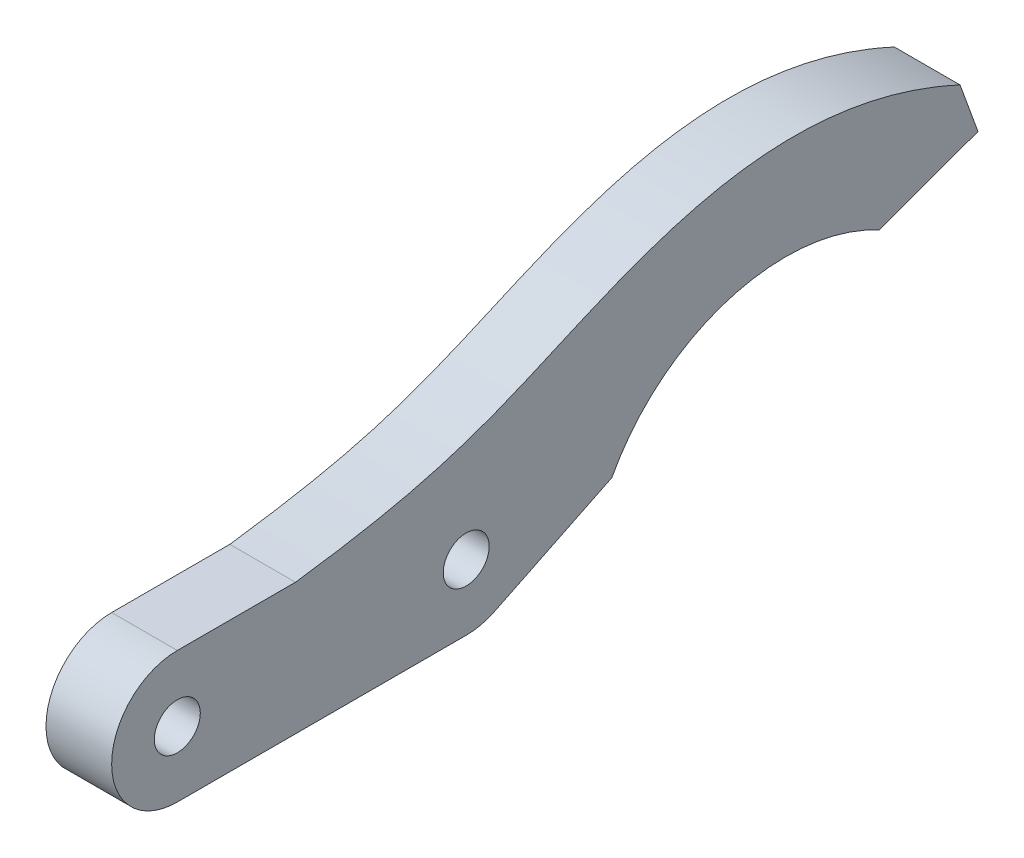
from build123d import *

# Parameters (mm, degrees)
SKETCH1_R           = 5
SKETCH1_R_2         = 1.75
BOSS_EXTRUDE1_DEPTH = 5
BOSS_EXTRUDE2_START = -5
BOSS_EXTRUDE2_DEPTH = 5


with BuildPart() as part:
    # Sketch1 → Boss-Extrude1 (new body)
    # profile 1 of 3: a face of its own
    with BuildSketch(Plane(origin=(0, 0, 0), x_dir=(0, 0, -1), z_dir=(1, 0, 0))):
        with Locations((5, 5)):
            Circle(SKETCH1_R)
        with Locations((5, 5)):
            Circle(SKETCH1_R_2, mode=Mode.SUBTRACT)
    # profile 2 of 3: a face of its own
    with BuildSketch(Plane(origin=(0, 0, 0), x_dir=(0, 0, -1), z_dir=(1, 0, 0))):
        with BuildLine():
            Line((27, 10), (5, 10))
            ThreePointArc((5, 10), (8.535533906, 8.535533906), (10, 5))
            ThreePointArc((10, 5), (8.535533906, 1.464466094), (5, 0))
            Line((5, 0), (27, 0))
            ThreePointArc((27, 0), (22, 5), (27, 10))
        make_face()
    # profile 3 of 3: a face of its own
    with BuildSketch(Plane(origin=(0, 0, 0), x_dir=(0, 0, -1), z_dir=(1, 0, 0))):
        with Locations((27, 5)):
            Circle(SKETCH1_R)
        with Locations((27, 5)):
            Circle(SKETCH1_R_2, mode=Mode.SUBTRACT)
    extrude(amount=BOSS_EXTRUDE1_DEPTH)

    # Sketch2 → Boss-Extrude2 (add)
    with BuildSketch(Plane(origin=(5, 0, 0), x_dir=(0, 0, -1), z_dir=(1, 0, 0)).offset(BOSS_EXTRUDE2_START)):
        with BuildLine():
            Line((65.975697465, 13.736161147), (64.607616892, 17.49493163))
            add(Edge.make_bspline(
                [(14, 10), (22.729658928, 11.165748207), (34.565066024, 15.059942726), (50.556554523, 24.001893285), (64.607616892, 17.49493163)],
                knots=[0, 0, 0, 0, 0.349113353, 1, 1, 1, 1], degree=3))
            Line((14, 10), (27, 10))
            ThreePointArc((27, 10), (31.871850324, 6.124755272), (29.191855734, 0.506029769))
            Line((29.191855734, 0.506029769), (38.089916792, 4.845904122))
            ThreePointArc((38.089916792, 4.845904122), (46.993994408, 12.1595138), (58.458156499, 11))
            Line((58.458156499, 11), (65.975697465, 13.736161147))
        make_face()
    extrude(amount=BOSS_EXTRUDE2_DEPTH)


solid = part.part
